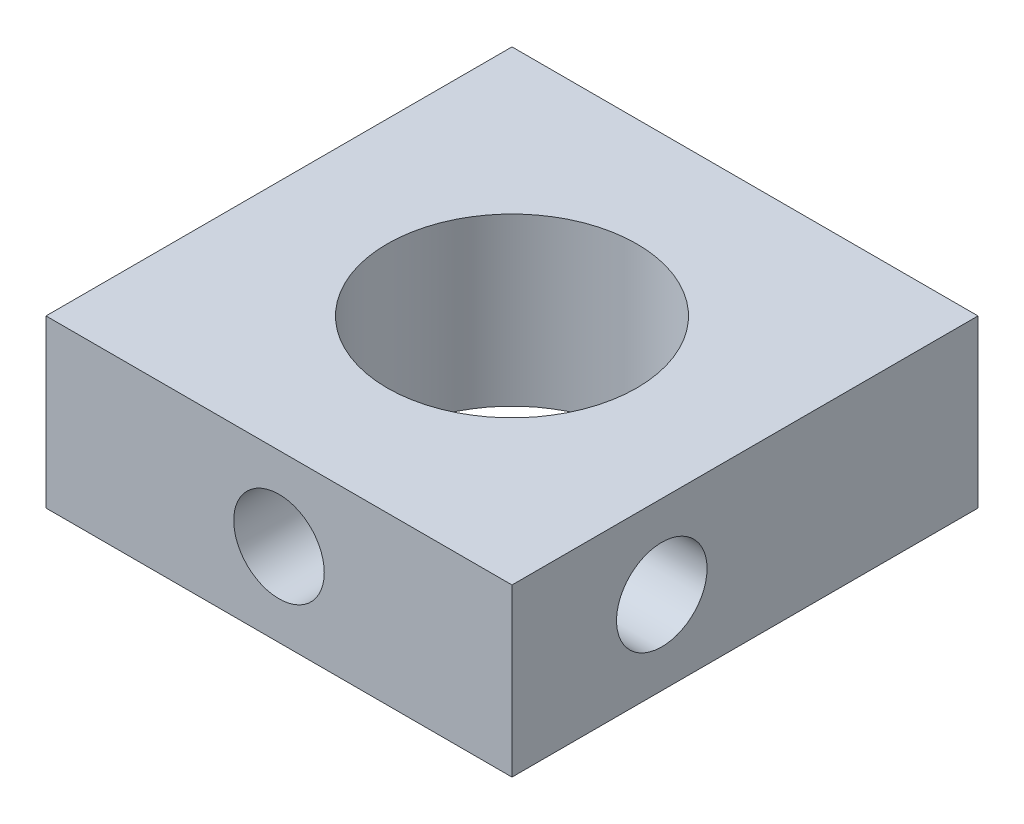
from build123d import *

# Parameters (mm, degrees)
SKETCH1_W                 = 17.78
SKETCH1_H                 = 17.78
SKETCH1_R                 = 4.7625
BOSS_EXTRUDE1_DEPTH       = 6.35
F_8_32_TAPPED_HOLE1_D     = 3.4544
F_8_32_TAPPED_HOLE1_DEPTH = 9.630193539
F_8_32_TAPPED_HOLE1_TIP   = 1.037806461


with BuildPart() as part:
    # Sketch1 → Boss-Extrude1 (new body)
    with BuildSketch(Plane(origin=(0, 0, 0), x_dir=(1, 0, 0), z_dir=(0, 1, 0))):
        Rectangle(SKETCH1_W, SKETCH1_H)
        with Locations(Location((0, 0, 0), (0, 0, 270))):
            Circle(SKETCH1_R, mode=Mode.SUBTRACT)
    extrude(amount=BOSS_EXTRUDE1_DEPTH)

    # #8-32 Tapped Hole1
    with Locations(Plane.XY.offset(8.89)):
        with Locations((0, 3.175)):
            Hole(F_8_32_TAPPED_HOLE1_D / 2, depth=F_8_32_TAPPED_HOLE1_DEPTH)
            with Locations((0, 0, -(F_8_32_TAPPED_HOLE1_DEPTH + F_8_32_TAPPED_HOLE1_TIP / 2))):  # 118° drill point
                Cone(0, F_8_32_TAPPED_HOLE1_D / 2, F_8_32_TAPPED_HOLE1_TIP, mode=Mode.SUBTRACT)

    # Sketch7 → #8-32 Tapped Hole2 (revolve, cut)
    with BuildSketch(Plane(origin=(-8.89, 3.175, 3.175), x_dir=(0, 0, 1), z_dir=(0, 1, 0))):
        Polygon((0, 0), (0, 4.847806461), (1.7272, 3.81), (1.7272, 0), align=None)
    f_8_32_tapped_hole2 = revolve(axis=Axis((-15.24, 3.175, 3.175), (1, 0, 0)), mode=Mode.SUBTRACT)

    # Mirror1: #8-32 Tapped Hole2 across plane
    add(f_8_32_tapped_hole2.mirror(Plane(origin=(0, 0, 0), x_dir=(0, 0, 1), z_dir=(1, 0, 0))), mode=Mode.SUBTRACT)


solid = part.part
